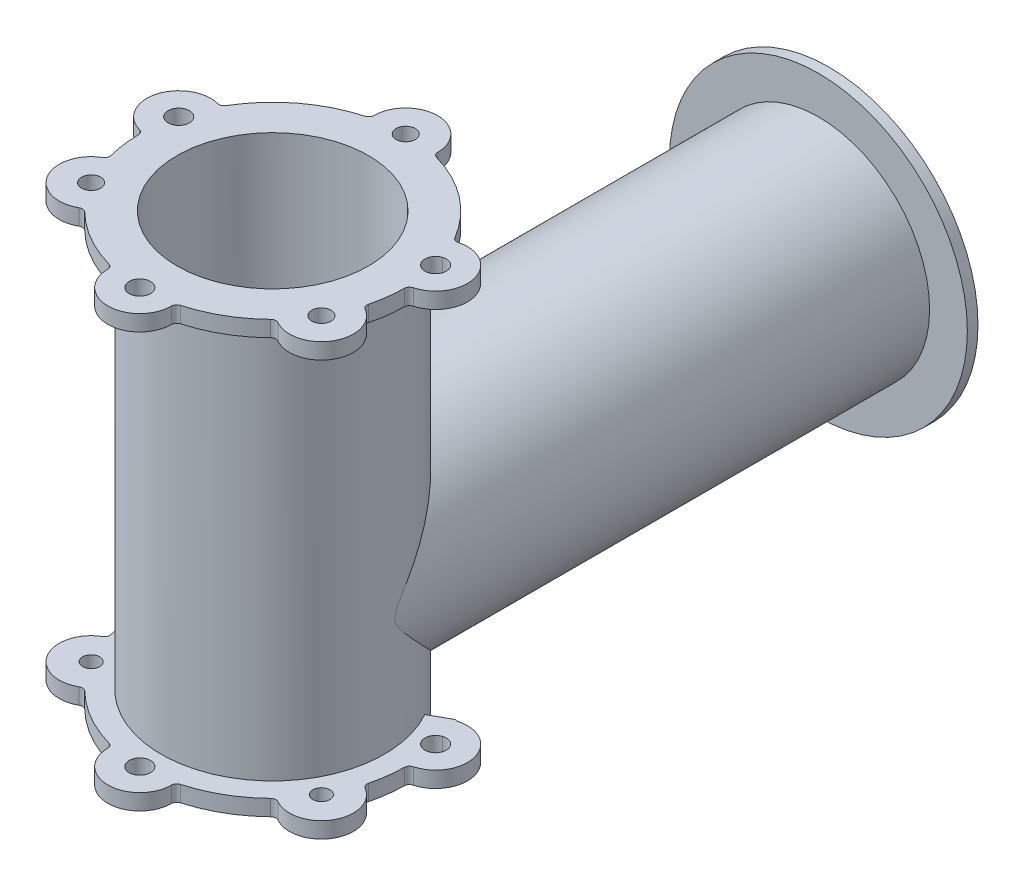
from build123d import *
from build123d.topology import SkipClean

# Parameters (mm, degrees)
SKETCH1_R             = 10.5
SKETCH1_R_2           = 9
BOSS_EXTRUDE1_DEPTH   = 37.5
SKETCH2_R             = 1
SKETCH2_R_2           = 9
BOSS_EXTRUDE2_DEPTH   = 1.5
FILLET1_R             = 0.5
FILLET1_OF_MIRROR1_R  = 0.5
SKETCH10_R            = 7.65
CUT_EXTRUDE1_DEPTH    = 45.592350079
SKETCH13_R            = 0.9
CUT_EXTRUDE2_DEPTH    = 1.5
M2X0_4_TAPPED_HOLE3_D = 1.6
SKETCH18_R            = 0.8
CUT_EXTRUDE4_DEPTH    = 1.5
SKETCH15_R            = 10.45
SKETCH15_R_2          = 9.55
BOSS_EXTRUDE3_DEPTH   = 51.3
SKETCH16_R            = 9
CUT_EXTRUDE3_DEPTH    = 68.075835388
SKETCH17_R            = 14
SKETCH17_R_2          = 9.55
BOSS_EXTRUDE4_DEPTH   = 1


with BuildPart() as part:
    # Sketch1 → Boss-Extrude1 (new body)
    with BuildSketch(Plane(origin=(0, 0, 0), x_dir=(1, 0, 0), z_dir=(0, 1, 0))):
        with Locations(Location((0, 0, 0), (0, 0, 270))):
            Circle(SKETCH1_R)
        with Locations(Location((0, 0, 0), (0, 0, 270))):
            Circle(SKETCH1_R_2, mode=Mode.SUBTRACT)
    extrude(amount=BOSS_EXTRUDE1_DEPTH)

    # Sketch2 → Boss-Extrude2 (add)
    with BuildSketch(Plane(origin=(0, 37.5, 0), x_dir=(1, 0, 0), z_dir=(0, 1, 0))):
        with BuildLine():
            Line((-3, -12.1346611), (-3, -12.5))
            ThreePointArc((-3, -12.5), (0, -15.5), (3, -12.5))
            Line((3, -12.5), (3, -12.1346611))
            ThreePointArc((3, -12.1346611), (6.25, -10.825317547), (9.008924778, -8.665406761))
            Line((9.008924778, -8.665406761), (9.325317547, -8.848076211))
            ThreePointArc((9.325317547, -8.848076211), (13.423393759, -7.75), (12.325317547, -3.651923789))
            Line((12.325317547, -3.651923789), (12.008924778, -3.469254338))
            ThreePointArc((12.008924778, -3.469254338), (12.393060767, -1.631577403), (12.497639685, 0.24290392))
            Line((12.497639685, 0.24290392), (12.850529964, 0.337460585))
            ThreePointArc((12.850529964, 0.337460585), (14.971850307, 4.011695199), (11.297615693, 6.133015543))
            Line((11.297615693, 6.133015543), (10.944725414, 6.038458877))
            ThreePointArc((10.944725414, 6.038458877), (7.609517863, 9.916916754), (3, 12.1346611))
            Line((3, 12.1346611), (3, 12.5))
            ThreePointArc((3, 12.5), (0, 15.5), (-3, 12.5))
            Line((-3, 12.5), (-3, 12.1346611))
            ThreePointArc((-3, 12.1346611), (-7.609517863, 9.916916754), (-10.944725414, 6.038458877))
            Line((-10.944725414, 6.038458877), (-11.297615693, 6.133015543))
            ThreePointArc((-11.297615693, 6.133015543), (-14.971850307, 4.011695199), (-12.850529964, 0.337460585))
            Line((-12.850529964, 0.337460585), (-12.497639685, 0.24290392))
            ThreePointArc((-12.497639685, 0.24290392), (-12.393060767, -1.631577403), (-12.008924778, -3.469254338))
            Line((-12.008924778, -3.469254338), (-12.325317547, -3.651923789))
            ThreePointArc((-12.325317547, -3.651923789), (-13.423393759, -7.75), (-9.325317547, -8.848076211))
            Line((-9.325317547, -8.848076211), (-9.008924778, -8.665406761))
            ThreePointArc((-9.008924778, -8.665406761), (-6.25, -10.825317547), (-3, -12.1346611))
        make_face()
        with Locations(Location((-12.074072829, 3.235238064, 0), (0, 0, 270))):
            Circle(SKETCH2_R, mode=Mode.SUBTRACT)
        with Locations(Location((0, 0, 0), (0, 0, 270))):
            Circle(SKETCH2_R_2, mode=Mode.SUBTRACT)
        with Locations((12.074072829, 3.235238064)):
            Circle(SKETCH2_R, mode=Mode.SUBTRACT)
        with Locations(Location((0, -12.5, 0), (0, 0, 270))):
            Circle(SKETCH2_R, mode=Mode.SUBTRACT)
    boss_extrude2 = extrude(amount=BOSS_EXTRUDE2_DEPTH)

    # Fillet1
    fillet1_edges = [part.edges().sort_by_distance(p)[0] for p in [
        (-3, 38.25, 12.1346611),
        (3, 38.25, 12.1346611),
        (9.008924778, 38.25, 8.665406761),
        (12.008924778, 38.25, 3.469254338),
        (12.497639685, 38.25, -0.24290392),
        (10.944725414, 38.25, -6.038458877),
        (3, 38.25, -12.1346611),
        (-3, 38.25, -12.1346611),
        (-10.944725414, 38.25, -6.038458877),
        (-12.497639685, 38.25, -0.24290392),
        (-12.008924778, 38.25, 3.469254338),
        (-9.008924778, 38.25, 8.665406761),
    ]]
    fillet(fillet1_edges, radius=FILLET1_R)

    # Mirror1: Boss-Extrude2 across plane
    add(boss_extrude2.mirror(Plane(origin=(0, 18.75, 0), x_dir=(0, 0, 1), z_dir=(0, -1, 0))))

    # Fillet1 of Mirror1
    fillet1_of_mirror1_edges = [part.edges().sort_by_distance(p)[0] for p in [
        (-3, -0.75, 12.1346611),
        (3, -0.75, 12.1346611),
        (9.008924778, -0.75, 8.665406761),
        (12.008924778, -0.75, 3.469254338),
        (12.497639685, -0.75, -0.24290392),
        (10.944725414, -0.75, -6.038458877),
        (3, -0.75, -12.1346611),
        (-3, -0.75, -12.1346611),
        (-10.944725414, -0.75, -6.038458877),
        (-12.497639685, -0.75, -0.24290392),
        (-12.008924778, -0.75, 3.469254338),
        (-9.008924778, -0.75, 8.665406761),
    ]]
    fillet(fillet1_of_mirror1_edges, radius=FILLET1_OF_MIRROR1_R)

    # Sketch10 → Cut-Extrude1 (cut, through all)
    with BuildSketch(Plane.XY):
        with Locations(Location((0, 10.55, 0), (0, 0, 90))):
            Circle(SKETCH10_R)
    extrude(amount=-CUT_EXTRUDE1_DEPTH, mode=Mode.SUBTRACT)

    # Sketch13 → Cut-Extrude2 (cut)
    with BuildSketch(Plane(origin=(0, 39, 0), x_dir=(1, 0, 0), z_dir=(0, 1, 0))):
        with Locations(Location((0, 12.5, 0), (0, 0, 270))):
            Circle(SKETCH13_R)
        with Locations(Location((-10.825317547, -6.25, 0), (0, 0, 270))):
            Circle(SKETCH13_R)
        with Locations(Location((10.825317547, -6.25, 0), (0, 0, 270))):
            Circle(SKETCH13_R)
    extrude(amount=-CUT_EXTRUDE2_DEPTH, mode=Mode.SUBTRACT)

    # M2x0.4 Tapped Hole3 (through all)
    with Locations(Plane(origin=(10.825317547, -1.5, 6.25), x_dir=(0, 0, -1), z_dir=(0, -1, 0))):
        with Locations((0, 0), (18.75, -10.825317547), (0, -21.650635094)):
            Hole(M2X0_4_TAPPED_HOLE3_D / 2)

    # Sketch18 → Cut-Extrude4 (cut)
    with BuildSketch(Plane.XZ.offset(1.5)):
        with BuildLine():
            ThreePointArc((9.161260567, -5.130429301), (0, -10.5), (-9.161260567, -5.130429301))
            Line((-9.161260567, -5.130429301), (-10.997370768, -6.158675742))
            ThreePointArc((-10.997370768, -6.158675742), (-10.860379047, -6.24299112), (-10.757249497, -6.366441962))
            ThreePointArc((-10.757249497, -6.366441962), (-7.609517863, -9.916916754), (-3.36532967, -12.038461538))
            ThreePointArc((-3.36532967, -12.038461538), (-3.102494954, -12.21662702), (-2.99995102, -12.517142857))
            ThreePointArc((-2.99995102, -12.517142857), (-2.115250735, -14.627372635), (2.8e-08, -15.5))
            ThreePointArc((2.8e-08, -15.5), (2.115250755, -14.627372615), (2.99995102, -12.517142857))
            ThreePointArc((2.99995102, -12.517142857), (3.102494954, -12.21662702), (3.36532967, -12.038461538))
            ThreePointArc((3.36532967, -12.038461538), (7.609517863, -9.916916754), (10.757249497, -6.366441962))
            ThreePointArc((10.757249497, -6.366441962), (10.860379047, -6.24299112), (10.997370768, -6.158675742))
            Line((10.997370768, -6.158675742), (9.161260567, -5.130429301))
        make_face()
        with Locations((0, -12.5)):
            Circle(SKETCH18_R, mode=Mode.SUBTRACT)
    extrude(amount=-CUT_EXTRUDE4_DEPTH, mode=Mode.SUBTRACT)

    # Sketch15 → Boss-Extrude3 (add)
    with BuildSketch(Plane.XY):
        with Locations((0, 10.55)):
            Circle(SKETCH15_R)
        with Locations((0, 10.55)):
            Circle(SKETCH15_R_2, mode=Mode.SUBTRACT)
    extrude(amount=-BOSS_EXTRUDE3_DEPTH)

    # Sketch16 → Cut-Extrude3 (cut, through all)
    with BuildSketch(Plane(origin=(0, 39, 0), x_dir=(1, 0, 0), z_dir=(0, 1, 0))):
        with Locations(Location((0, 0, 0), (0, 0, 270))):
            Circle(SKETCH16_R)
    extrude(amount=-CUT_EXTRUDE3_DEPTH, mode=Mode.SUBTRACT)

    # Sketch17 → Boss-Extrude4 (add)
    with SkipClean():  # the faces are left unmerged after this step: merging them gives an invalid solid
        with BuildSketch(Plane(origin=(0, 0, -51.3), x_dir=(-1, 0, 0), z_dir=(0, 0, -1))):
            with Locations((0, 10.55)):
                Circle(SKETCH17_R)
            with Locations(Location((0, 10.55, 0), (0, 0, 90))):
                Circle(SKETCH17_R_2, mode=Mode.SUBTRACT)
        extrude(amount=BOSS_EXTRUDE4_DEPTH)


solid = part.part
